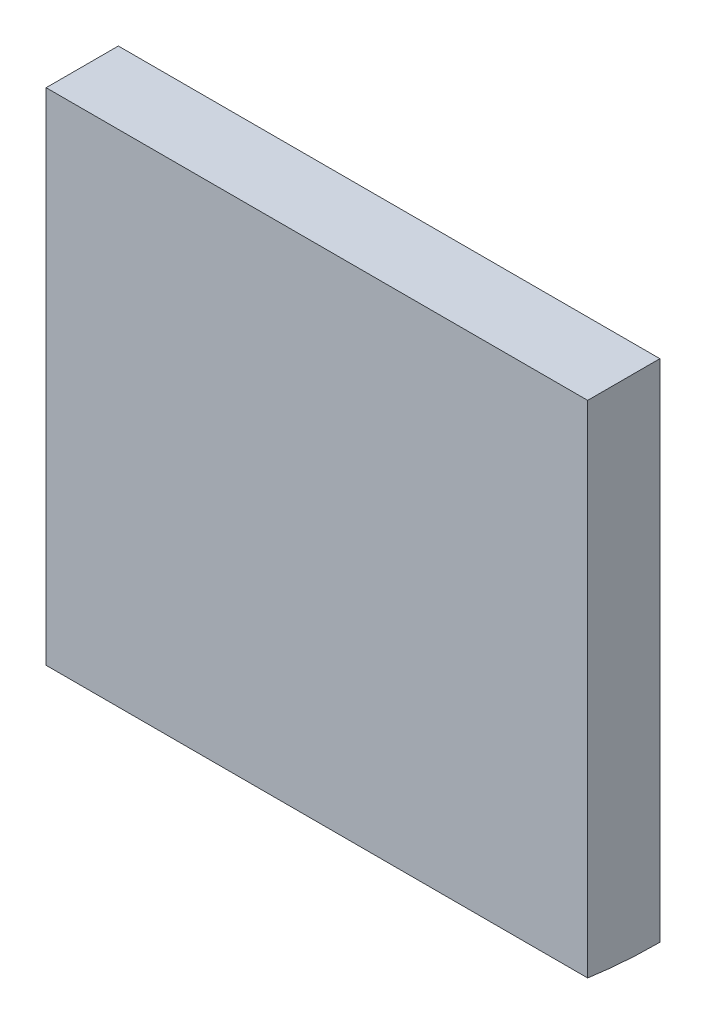
from build123d import *

# Parameters (mm, degrees)
SKETCH1_W           = 150
SKETCH1_H           = 140
BOSS_EXTRUDE1_DEPTH = 20
CUT_EXTRUDE1_REACH  = 168.733


with BuildPart() as part:
    # Sketch1 → Boss-Extrude1 (new body)
    with BuildSketch(Plane.XY):
        Rectangle(SKETCH1_W, SKETCH1_H)
    extrude(amount=BOSS_EXTRUDE1_DEPTH)

    # Sketch2 → Cut-Extrude1 (cut, up to next)
    with BuildSketch(Plane.ZY.offset(75), mode=Mode.PRIVATE) as cut_extrude1_sk1:
        with BuildLine():
            Line((20, -68.564064606), (20, -70))
            Line((20, -70), (0, -70))
            ThreePointArc((0, -70), (10.025740751, -69.64055472), (20, -68.564064606))
        make_face()
    cut_extrude1_tool1 = extrude(cut_extrude1_sk1.sketch, amount=-CUT_EXTRUDE1_REACH, mode=Mode.PRIVATE) & part.part
    add(cut_extrude1_tool1.solids().sort_by_distance((-75, -69.569601, 15.005143))[0], mode=Mode.SUBTRACT)


solid = part.part
